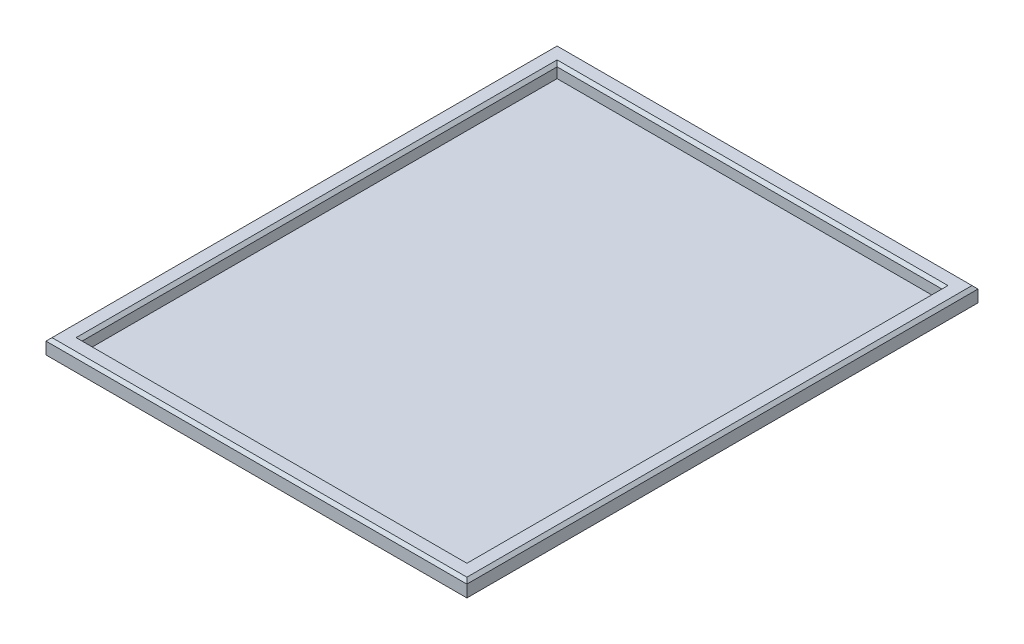
from build123d import *

# Parameters (mm, degrees)
SKETCH3_W           = 700
SKETCH3_H           = 850
SKETCH3_W_2         = 640
SKETCH3_H_2         = 790
BOSS_EXTRUDE1_DEPTH = 30
CHAMFER2_SIZE       = 5
SKETCH4_W           = 640
SKETCH4_H           = 790
BOSS_EXTRUDE2_DEPTH = 8


with BuildPart() as part:
    # Sketch3 → Boss-Extrude1 (new body)
    with BuildSketch(Plane(origin=(0, 0, 0), x_dir=(1, 0, 0), z_dir=(0, 1, 0))):
        Rectangle(SKETCH3_W, SKETCH3_H)
        Rectangle(SKETCH3_W_2, SKETCH3_H_2, mode=Mode.SUBTRACT)
    extrude(amount=BOSS_EXTRUDE1_DEPTH)

    # Chamfer2
    chamfer2_edges = [part.edges().sort_by_distance(p)[0] for p in [
        (-350, 30, 0),
        (-320, 30, 0),
        (0, 30, 425),
        (0, 30, 395),
        (320, 30, 0),
        (0, 30, -395),
        (350, 30, 0),
        (0, 0, 425),
        (-350, 0, 0),
        (0, 0, -425),
        (350, 0, 0),
        (0, 30, -425),
    ]]
    chamfer(chamfer2_edges, length=CHAMFER2_SIZE)


with BuildPart() as body_2:
    # Sketch4 → Boss-Extrude2 (new body)
    with BuildSketch(Plane.XZ):
        Rectangle(SKETCH4_W, SKETCH4_H)
    extrude(amount=-BOSS_EXTRUDE2_DEPTH)


solid = Compound([part.part, body_2.part])
